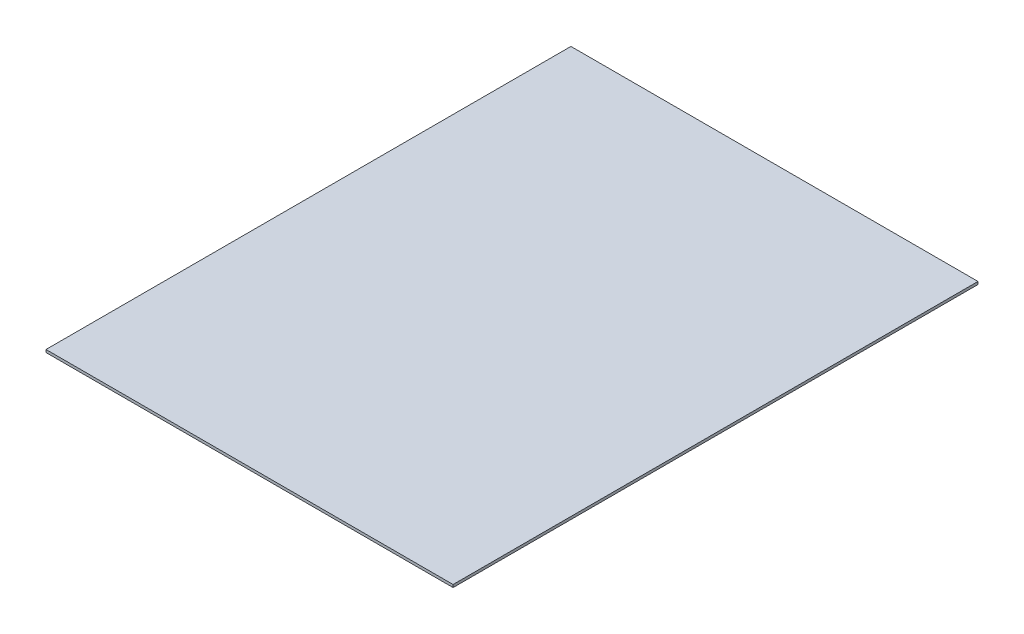
from build123d import *

# Parameters (mm, degrees)
SKETCH1_W           = 482.6
SKETCH1_H           = 622.3
BOSS_EXTRUDE1_DEPTH = 3.175


with BuildPart() as part:
    # Sketch1 → Boss-Extrude1 (new body)
    with BuildSketch(Plane(origin=(0, 0, 0), x_dir=(1, 0, 0), z_dir=(0, 1, 0))):
        Rectangle(SKETCH1_W, SKETCH1_H)
    extrude(amount=BOSS_EXTRUDE1_DEPTH)


solid = part.part
